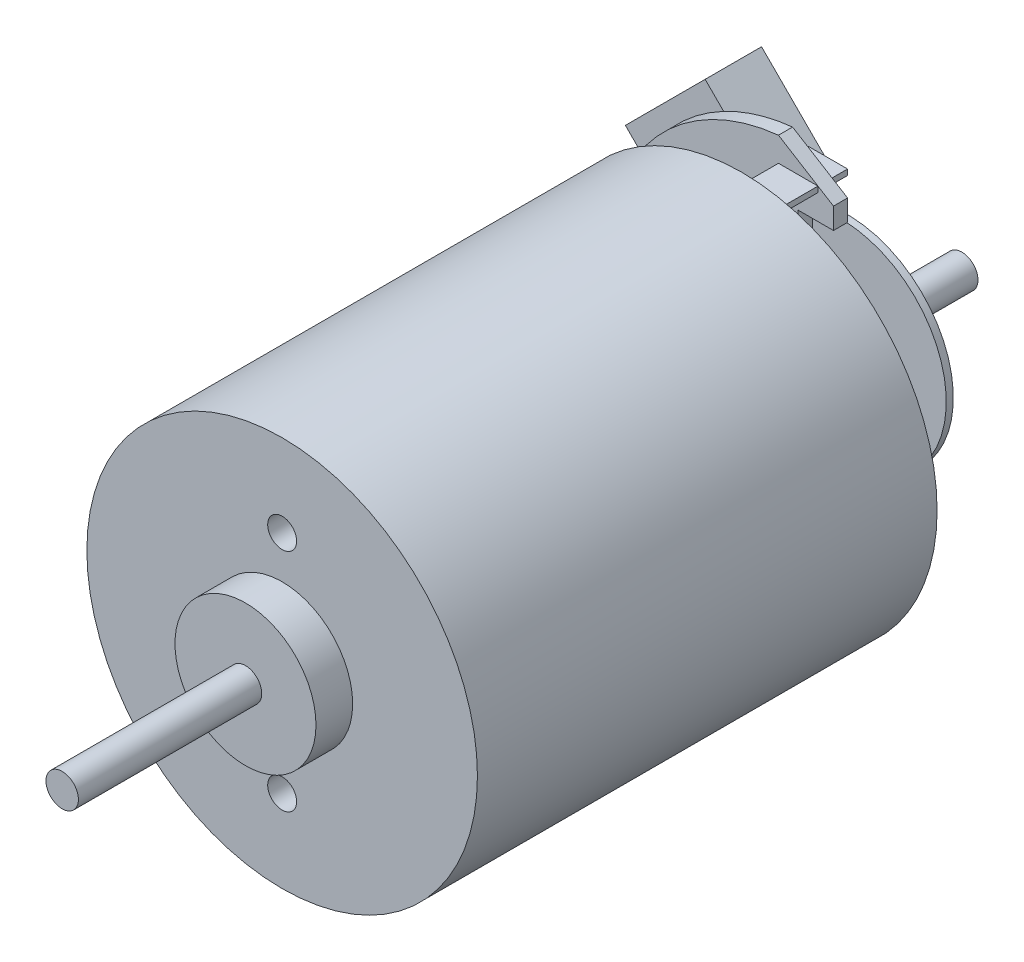
from build123d import *

# Parameters (mm, degrees)
MAINBODY_DEPTH               = 16.3
MAINBODY_DEPTH_BACK          = 16.3
SKETCH1_R                    = 13.85
SKETCH2_R                    = 1.15
OUTPUTSHAFT_DEPTH            = 15.6
SKETCH2_3_R                  = 5
SKETCH2_3_R_2                = 1.15
OUTPUTBOSS_DEPTH             = 2.6
M2_5X0_45_TAPPED_HOLE1_D     = 2.05
M2_5X0_45_TAPPED_HOLE1_DEPTH = 6.35
M2_5X0_45_TAPPED_HOLE1_TIP   = 0.615882135
SKETCH5_W                    = 2.8
SKETCH5_H                    = 0.4
TERMINALS_DEPTH              = 6.1
PCB_START                    = 4
PCB_DEPTH                    = 1
ENCODER_START                = 7
SKETCH9_R                    = 7.5
ENCODER_DEPTH                = 0.5
CONNECTOR_DEPTH              = 4


with BuildPart() as part:
    # Sketch1 → MAINBODY (new, two sides: drawn at the far end of the back side and taken through both)
    with BuildSketch(Plane.XY.offset(-MAINBODY_DEPTH_BACK)):
        Circle(SKETCH1_R)
    extrude(amount=MAINBODY_DEPTH + MAINBODY_DEPTH_BACK)

    # Sketch2 → OUTPUTSHAFT (add)
    with BuildSketch(Plane.XY.offset(16.3)):
        Circle(SKETCH2_R)
    outputshaft = extrude(amount=OUTPUTSHAFT_DEPTH)

    # Sketch2<3> → OUTPUTBOSS (add)
    with BuildSketch(Plane.XY.offset(16.3)):
        Circle(SKETCH2_3_R)
        Circle(SKETCH2_3_R_2, mode=Mode.SUBTRACT)
    outputboss = extrude(amount=OUTPUTBOSS_DEPTH)

    # M2.5x0.45 Tapped Hole1
    with Locations(Plane.XY.offset(16.3)):
        with Locations((0, 8), (0, -8)):
            Hole(M2_5X0_45_TAPPED_HOLE1_D / 2, depth=M2_5X0_45_TAPPED_HOLE1_DEPTH)
            with Locations((0, 0, -(M2_5X0_45_TAPPED_HOLE1_DEPTH + M2_5X0_45_TAPPED_HOLE1_TIP / 2))):  # 118° drill point
                Cone(0, M2_5X0_45_TAPPED_HOLE1_D / 2, M2_5X0_45_TAPPED_HOLE1_TIP, mode=Mode.SUBTRACT)

    # REARSHAFT: OUTPUTSHAFT, OUTPUTBOSS across plane
    add(outputshaft.mirror(Plane.XY))
    add(outputboss.mirror(Plane.XY))

    # Sketch5 → TERMINALS (add)
    with BuildSketch(Plane(origin=(0, 0, -16.3), x_dir=(-1, 0, 0), z_dir=(0, 0, -1))):
        with Locations((0, 11.5)):
            Rectangle(SKETCH5_W, SKETCH5_H)
        with Locations((0, -11.5)):
            Rectangle(SKETCH5_W, SKETCH5_H)
    extrude(amount=TERMINALS_DEPTH)

    # Sketch8 → PCB (add)
    with BuildSketch(Plane(origin=(0, 0, -16.3), x_dir=(-1, 0, 0), z_dir=(0, 0, -1)).offset(PCB_START)):
        with BuildLine():
            Line((1.4, 13.427211177), (-2.5, 11.021452752))
            Line((-2.5, 11.021452752), (-2.5, 9.521452752))
            Line((-2.5, 9.521452752), (0, 9.521452752))
            Line((0, 9.521452752), (0, 5))
            ThreePointArc((0, 5), (5, 0), (0, -5))
            Line((0, -5), (0, -9.521452752))
            Line((0, -9.521452752), (-2.5, -9.521452752))
            Line((-2.5, -9.521452752), (-2.5, -11.021452752))
            Line((-2.5, -11.021452752), (1.4, -13.427211177))
            ThreePointArc((1.4, -13.427211177), (13.5, 0), (1.4, 13.427211177))
        make_face()
    extrude(amount=PCB_DEPTH)

    # Sketch9 → ENCODER (add)
    with BuildSketch(Plane(origin=(0, 0, -16.3), x_dir=(-1, 0, 0), z_dir=(0, 0, -1)).offset(ENCODER_START)):
        Circle(SKETCH9_R)
    extrude(amount=ENCODER_DEPTH)

    # Sketch10 → CONNECTOR (add)
    with BuildSketch(Plane(origin=(0, 0, -21.3), x_dir=(-1, 0, 0), z_dir=(0, 0, -1))):
        Polygon((2.651397898, 8.308757211), (8.308252147, 2.651902961), (13.257999616, 7.601650429), (7.601145366, 13.258504679), align=None)
    extrude(amount=CONNECTOR_DEPTH)


solid = part.part
